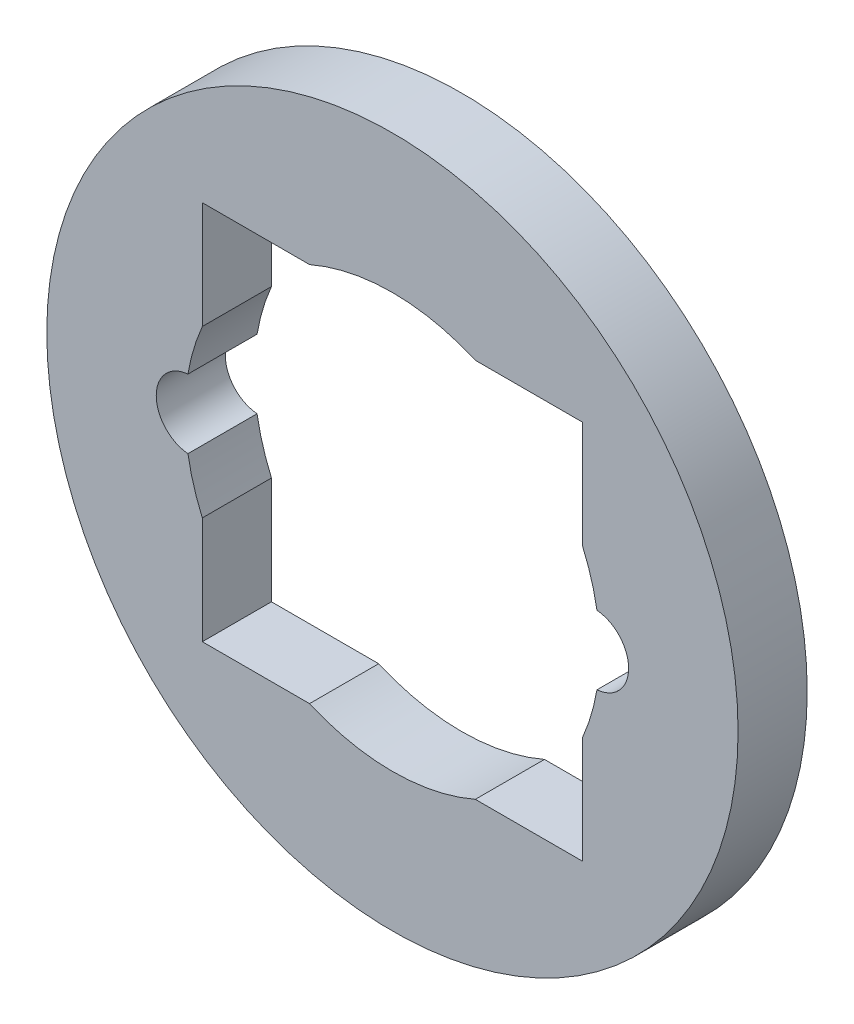
from build123d import *

# Parameters (mm, degrees)
SKETCH1_R           = 15
BOSS_EXTRUDE1_DEPTH = 3


with BuildPart() as part:
    # Sketch1 → Boss-Extrude1 (new body)
    with BuildSketch(Plane.XY):
        Circle(SKETCH1_R)
        with BuildLine():
            ThreePointArc((8.875, 1.494782593), (8.626766656, 2.564936072), (8.25, 3.596873642))
            Line((8.25, 3.596873642), (8.25, 8.25))
            Line((8.25, 8.25), (3.596873642, 8.25))
            ThreePointArc((3.596873642, 8.25), (0, 9), (-3.596873642, 8.25))
            Line((-3.596873642, 8.25), (-8.25, 8.25))
            Line((-8.25, 8.25), (-8.25, 3.596873642))
            ThreePointArc((-8.25, 3.596873642), (-8.626766656, 2.564936072), (-8.875, 1.494782593))
            ThreePointArc((-8.875, 1.494782593), (-10.25, 0), (-8.875, -1.494782593))
            ThreePointArc((-8.875, -1.494782593), (-8.626766656, -2.564936072), (-8.25, -3.596873642))
            Line((-8.25, -3.596873642), (-8.25, -8.25))
            Line((-8.25, -8.25), (-3.596873642, -8.25))
            ThreePointArc((-3.596873642, -8.25), (0, -9), (3.596873642, -8.25))
            Line((3.596873642, -8.25), (8.25, -8.25))
            Line((8.25, -8.25), (8.25, -3.596873642))
            ThreePointArc((8.25, -3.596873642), (8.626766656, -2.564936072), (8.875, -1.494782593))
            ThreePointArc((8.875, -1.494782593), (10.25, 0), (8.875, 1.494782593))
        make_face(mode=Mode.SUBTRACT)
    extrude(amount=BOSS_EXTRUDE1_DEPTH)


solid = part.part
